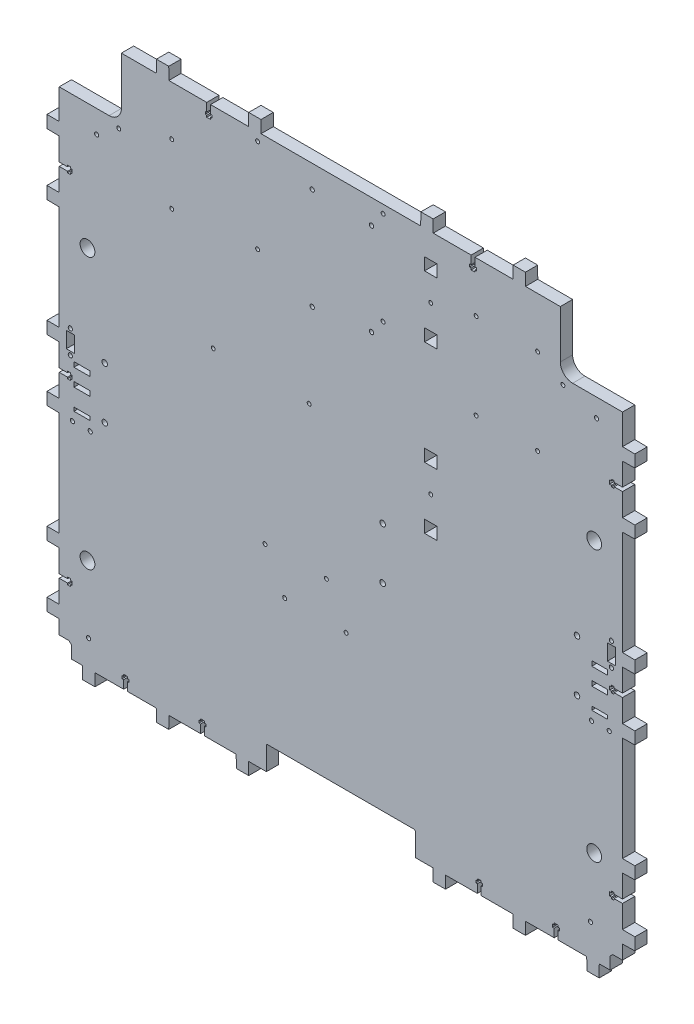
from build123d import *

# Parameters (mm, degrees)
SKETCH_1_R      = 1.6
SKETCH_1_R_2    = 1.7
SKETCH_1_R_3    = 1.75
SKETCH_1_R_4    = 6
SKETCH_1_R_5    = 2.25
SKETCH_1_W      = 6.5
SKETCH_1_H      = 13
SKETCH_1_W_2    = 13
SKETCH_1_H_2    = 4
SKETCH_1_H_3    = 3
SKETCH_1_W_3    = 10.1
SKETCH_1_H_4    = 10
EXTRUDE_1_DEPTH = 10


with BuildPart() as part:
    # Эскиз1 → Бобышка-Вытянуть1 (new body)
    with BuildSketch(Plane.XY):
        with BuildLine():
            Line((114.049433297, -213), (110.949433297, -213))
            Line((110.949433297, -213), (110.949433297, -214.5))
            Line((110.949433297, -214.5), (109.749433297, -214.5))
            Line((109.749433297, -214.5), (109.749433297, -216.7))
            Line((109.749433297, -216.7), (110.949433297, -216.7))
            Line((110.949433297, -216.7), (110.949433297, -223.5))
            Line((110.949433297, -223.5), (85.099433297, -223.5))
            Line((85.099433297, -223.5), (85.06607682, -233.4986114))
            Line((85.06607682, -233.4986114), (75.06607682, -233.4986114))
            Line((75.06607682, -233.4986114), (74.899433297, -223.5))
            Line((74.899433297, -223.5), (60.499433297, -223.5))
            Line((60.499433297, -223.5), (60.499433297, -205))
            ThreePointArc((60.499433297, -205), (60.206540078, -204.292893219), (59.499433297, -204))
            Line((59.499433297, -204), (-59.500566703, -204))
            ThreePointArc((-59.500566703, -204), (-60.207673484, -204.292893219), (-60.500566703, -205))
            Line((-60.500566703, -205), (-60.500566703, -223.5))
            Line((-60.500566703, -223.5), (-74.900566703, -223.5))
            Line((-74.900566703, -223.5), (-74.93392318, -233.4986114))
            Line((-74.93392318, -233.4986114), (-84.93392318, -233.4986114))
            Line((-84.93392318, -233.4986114), (-85.100566703, -223.5))
            Line((-85.100566703, -223.5), (-110.950566703, -223.5))
            Line((-110.950566703, -223.5), (-110.950566703, -216.7))
            Line((-110.950566703, -216.7), (-109.750566703, -216.7))
            Line((-109.750566703, -216.7), (-109.750566703, -214.5))
            Line((-109.750566703, -214.5), (-110.950566703, -214.5))
            Line((-110.950566703, -214.5), (-110.950566703, -213))
            Line((-110.950566703, -213), (-114.050566703, -213))
            Line((-114.050566703, -213), (-114.050566703, -214.5))
            Line((-114.050566703, -214.5), (-115.250566703, -214.5))
            Line((-115.250566703, -214.5), (-115.250566703, -216.7))
            Line((-115.250566703, -216.7), (-114.050566703, -216.7))
            Line((-114.050566703, -216.7), (-114.050566703, -223.5))
            Line((-114.050566703, -223.5), (-139.900566703, -223.5))
            Line((-139.900566703, -223.5), (-139.93392318, -233.4986114))
            Line((-139.93392318, -233.4986114), (-149.93392318, -233.4986114))
            Line((-149.93392318, -233.4986114), (-150.100566703, -223.5))
            Line((-150.100566703, -223.5), (-173.450566703, -223.5))
            Line((-173.450566703, -223.5), (-173.450566703, -216.7))
            Line((-173.450566703, -216.7), (-172.250566703, -216.7))
            Line((-172.250566703, -216.7), (-172.250566703, -214.5))
            Line((-172.250566703, -214.5), (-173.450566703, -214.5))
            Line((-173.450566703, -214.5), (-173.450566703, -213))
            Line((-173.450566703, -213), (-176.550566703, -213))
            Line((-176.550566703, -213), (-176.550566703, -214.5))
            Line((-176.550566703, -214.5), (-177.750566703, -214.5))
            Line((-177.750566703, -214.5), (-177.750566703, -216.7))
            Line((-177.750566703, -216.7), (-176.550566703, -216.7))
            Line((-176.550566703, -216.7), (-176.550566703, -223.5))
            Line((-176.550566703, -223.5), (-199.900566703, -223.5))
            Line((-199.900566703, -223.5), (-199.93392318, -233.4986114))
            Line((-199.93392318, -233.4986114), (-209.93392318, -233.4986114))
            Line((-209.93392318, -233.4986114), (-210.100566703, -223.5))
            Line((-210.100566703, -223.5), (-219.000566703, -223.5))
            Line((-219.000566703, -223.5), (-219.000566703, -213.5))
            Line((-219.000566703, -213.5), (-221.000566703, -211.5))
            Line((-221.000566703, -211.5), (-229.000566703, -211.5))
            Line((-229.000566703, -211.5), (-229.000566703, -200.1))
            Line((-229.000566703, -200.1), (-238.999178103, -199.933356477))
            Line((-238.999178103, -199.933356477), (-238.999178103, -189.933356477))
            Line((-238.999178103, -189.933356477), (-229.000566703, -189.9))
            Line((-229.000566703, -189.9), (-229.000566703, -171.55))
            Line((-229.000566703, -171.55), (-222.200566703, -171.55))
            Line((-222.200566703, -171.55), (-222.200566703, -172.75))
            Line((-222.200566703, -172.75), (-220.000566703, -172.75))
            Line((-220.000566703, -172.75), (-220.000566703, -171.55))
            Line((-220.000566703, -171.55), (-218.500566703, -171.55))
            Line((-218.500566703, -171.55), (-218.500566703, -168.45))
            Line((-218.500566703, -168.45), (-220.000566703, -168.45))
            Line((-220.000566703, -168.45), (-220.000566703, -167.25))
            Line((-220.000566703, -167.25), (-222.200566703, -167.25))
            Line((-222.200566703, -167.25), (-222.200566703, -168.45))
            Line((-222.200566703, -168.45), (-229.000566703, -168.45))
            Line((-229.000566703, -168.45), (-229.000566703, -150.1))
            Line((-229.000566703, -150.1), (-238.999178103, -149.933356477))
            Line((-238.999178103, -149.933356477), (-238.999178103, -139.933356477))
            Line((-238.999178103, -139.933356477), (-229.000566703, -139.9))
            Line((-229.000566703, -139.9), (-229.000566703, -55.1))
            Line((-229.000566703, -55.1), (-238.999178103, -54.933356477))
            Line((-238.999178103, -54.933356477), (-238.999178103, -44.933356477))
            Line((-238.999178103, -44.933356477), (-229.000566703, -44.9))
            Line((-229.000566703, -44.9), (-229.000566703, -26.55))
            Line((-229.000566703, -26.55), (-222.200566703, -26.55))
            Line((-222.200566703, -26.55), (-222.200566703, -27.75))
            Line((-222.200566703, -27.75), (-220.000566703, -27.75))
            Line((-220.000566703, -27.75), (-220.000566703, -26.55))
            Line((-220.000566703, -26.55), (-218.500566703, -26.55))
            Line((-218.500566703, -26.55), (-218.500566703, -23.45))
            Line((-218.500566703, -23.45), (-220.000566703, -23.45))
            Line((-220.000566703, -23.45), (-220.000566703, -22.25))
            Line((-220.000566703, -22.25), (-222.200566703, -22.25))
            Line((-222.200566703, -22.25), (-222.200566703, -23.45))
            Line((-222.200566703, -23.45), (-229.000566703, -23.45))
            Line((-229.000566703, -23.45), (-229.000566703, -5.1))
            Line((-229.000566703, -5.1), (-238.999178103, -4.933356477))
            Line((-238.999178103, -4.933356477), (-238.999178103, 5.066643523))
            Line((-238.999178103, 5.066643523), (-229.000566703, 5.1))
            Line((-229.000566703, 5.1), (-229.000566703, 89.9))
            Line((-229.000566703, 89.9), (-238.999178103, 90.066643523))
            Line((-238.999178103, 90.066643523), (-238.999178103, 100.066643523))
            Line((-238.999178103, 100.066643523), (-229.000566703, 100.1))
            Line((-229.000566703, 100.1), (-229.000566703, 118.45))
            Line((-229.000566703, 118.45), (-222.200566703, 118.45))
            Line((-222.200566703, 118.45), (-222.200566703, 117.25))
            Line((-222.200566703, 117.25), (-220.000566703, 117.25))
            Line((-220.000566703, 117.25), (-220.000566703, 118.45))
            Line((-220.000566703, 118.45), (-218.500566703, 118.45))
            Line((-218.500566703, 118.45), (-218.500566703, 121.55))
            Line((-218.500566703, 121.55), (-220.000566703, 121.55))
            Line((-220.000566703, 121.55), (-220.000566703, 122.75))
            Line((-220.000566703, 122.75), (-222.200566703, 122.75))
            Line((-222.200566703, 122.75), (-222.200566703, 121.55))
            Line((-222.200566703, 121.55), (-229.000566703, 121.55))
            Line((-229.000566703, 121.55), (-229.000566703, 139.9))
            Line((-229.000566703, 139.9), (-238.999178103, 140.066643523))
            Line((-238.999178103, 140.066643523), (-238.999178103, 150.066643523))
            Line((-238.999178103, 150.066643523), (-229.000566703, 150.1))
            Line((-229.000566703, 150.1), (-229.000566703, 174.5))
            Line((-229.000566703, 174.5), (-188.450566703, 174.5))
            ThreePointArc((-188.450566703, 174.5), (-181.379498891, 177.428932188), (-178.450566703, 184.5))
            Line((-178.450566703, 184.5), (-178.450566703, 223.5))
            Line((-178.450566703, 223.5), (-150.100566703, 223.5))
            Line((-150.100566703, 223.5), (-149.93392318, 233.4986114))
            Line((-149.93392318, 233.4986114), (-139.93392318, 233.4986114))
            Line((-139.93392318, 233.4986114), (-139.900566703, 223.5))
            Line((-139.900566703, 223.5), (-109.050566703, 223.5))
            Line((-109.050566703, 223.5), (-109.050566703, 216.7))
            Line((-109.050566703, 216.7), (-110.250566703, 216.7))
            Line((-110.250566703, 216.7), (-110.250566703, 214.5))
            Line((-110.250566703, 214.5), (-109.050566703, 214.5))
            Line((-109.050566703, 214.5), (-109.050566703, 213))
            Line((-109.050566703, 213), (-105.950566703, 213))
            Line((-105.950566703, 213), (-105.950566703, 214.5))
            Line((-105.950566703, 214.5), (-104.750566703, 214.5))
            Line((-104.750566703, 214.5), (-104.750566703, 216.7))
            Line((-104.750566703, 216.7), (-105.950566703, 216.7))
            Line((-105.950566703, 216.7), (-105.950566703, 223.5))
            Line((-105.950566703, 223.5), (-75.100566703, 223.5))
            Line((-75.100566703, 223.5), (-74.93392318, 233.4986114))
            Line((-74.93392318, 233.4986114), (-64.93392318, 233.4986114))
            Line((-64.93392318, 233.4986114), (-64.900566703, 223.5))
            Line((-64.900566703, 223.5), (64.899433297, 223.5))
            Line((64.899433297, 223.5), (65.06607682, 233.4986114))
            Line((65.06607682, 233.4986114), (75.06607682, 233.4986114))
            Line((75.06607682, 233.4986114), (75.099433297, 223.5))
            Line((75.099433297, 223.5), (105.949433297, 223.5))
            Line((105.949433297, 223.5), (105.949433297, 216.7))
            Line((105.949433297, 216.7), (104.749433297, 216.7))
            Line((104.749433297, 216.7), (104.749433297, 214.5))
            Line((104.749433297, 214.5), (105.949433297, 214.5))
            Line((105.949433297, 214.5), (105.949433297, 213))
            Line((105.949433297, 213), (109.049433297, 213))
            Line((109.049433297, 213), (109.049433297, 214.5))
            Line((109.049433297, 214.5), (110.249433297, 214.5))
            Line((110.249433297, 214.5), (110.249433297, 216.7))
            Line((110.249433297, 216.7), (109.049433297, 216.7))
            Line((109.049433297, 216.7), (109.049433297, 223.5))
            Line((109.049433297, 223.5), (139.899433297, 223.5))
            Line((139.899433297, 223.5), (140.06607682, 233.4986114))
            Line((140.06607682, 233.4986114), (150.06607682, 233.4986114))
            Line((150.06607682, 233.4986114), (150.099433297, 223.5))
            Line((150.099433297, 223.5), (178.449433297, 223.5))
            Line((178.449433297, 223.5), (178.449433297, 184.5))
            ThreePointArc((178.449433297, 184.5), (181.378365485, 177.428932188), (188.449433297, 174.5))
            Line((188.449433297, 174.5), (228.999433297, 174.5))
            Line((228.999433297, 174.5), (228.999433297, 150.1))
            Line((228.999433297, 150.1), (238.998044697, 149.933356477))
            Line((238.998044697, 149.933356477), (238.998044697, 140.066643523))
            Line((238.998044697, 140.066643523), (228.999433297, 139.9))
            Line((228.999433297, 139.9), (228.999433297, 121.55))
            Line((228.999433297, 121.55), (222.199433297, 121.55))
            Line((222.199433297, 121.55), (222.199433297, 122.75))
            Line((222.199433297, 122.75), (219.999433297, 122.75))
            Line((219.999433297, 122.75), (219.999433297, 121.55))
            Line((219.999433297, 121.55), (218.499433297, 121.55))
            Line((218.499433297, 121.55), (218.499433297, 118.45))
            Line((218.499433297, 118.45), (219.999433297, 118.45))
            Line((219.999433297, 118.45), (219.999433297, 117.25))
            Line((219.999433297, 117.25), (222.199433297, 117.25))
            Line((222.199433297, 117.25), (222.199433297, 118.45))
            Line((222.199433297, 118.45), (228.999433297, 118.45))
            Line((228.999433297, 118.45), (228.999433297, 100.1))
            Line((228.999433297, 100.1), (238.998044697, 99.933356477))
            Line((238.998044697, 99.933356477), (238.998044697, 90.066643523))
            Line((238.998044697, 90.066643523), (228.999433297, 89.9))
            Line((228.999433297, 89.9), (228.999433297, 5.1))
            Line((228.999433297, 5.1), (238.998044697, 4.933356477))
            Line((238.998044697, 4.933356477), (238.999178103, -5.02855908))
            Line((238.999178103, -5.02855908), (228.999433297, -5.1))
            Line((228.999433297, -5.1), (228.999433297, -23.45))
            Line((228.999433297, -23.45), (222.199433297, -23.45))
            Line((222.199433297, -23.45), (222.199433297, -22.25))
            Line((222.199433297, -22.25), (219.999433297, -22.25))
            Line((219.999433297, -22.25), (219.999433297, -23.45))
            Line((219.999433297, -23.45), (218.499433297, -23.45))
            Line((218.499433297, -23.45), (218.499433297, -26.55))
            Line((218.499433297, -26.55), (219.999433297, -26.55))
            Line((219.999433297, -26.55), (219.999433297, -27.75))
            Line((219.999433297, -27.75), (222.199433297, -27.75))
            Line((222.199433297, -27.75), (222.199433297, -26.55))
            Line((222.199433297, -26.55), (228.999433297, -26.55))
            Line((228.999433297, -26.55), (228.999433297, -44.9))
            Line((228.999433297, -44.9), (238.998044697, -45.066643523))
            Line((238.998044697, -45.066643523), (238.998044697, -54.933356477))
            Line((238.998044697, -54.933356477), (228.999433297, -55.1))
            Line((228.999433297, -55.1), (228.999433297, -139.9))
            Line((228.999433297, -139.9), (238.998044697, -140.066643523))
            Line((238.998044697, -140.066643523), (238.998044697, -149.933356477))
            Line((238.998044697, -149.933356477), (228.999433297, -150.1))
            Line((228.999433297, -150.1), (228.999433297, -168.45))
            Line((228.999433297, -168.45), (222.199433297, -168.45))
            Line((222.199433297, -168.45), (222.199433297, -167.25))
            Line((222.199433297, -167.25), (219.999433297, -167.25))
            Line((219.999433297, -167.25), (219.999433297, -168.45))
            Line((219.999433297, -168.45), (218.499433297, -168.45))
            Line((218.499433297, -168.45), (218.499433297, -171.55))
            Line((218.499433297, -171.55), (219.999433297, -171.55))
            Line((219.999433297, -171.55), (219.999433297, -172.75))
            Line((219.999433297, -172.75), (222.199433297, -172.75))
            Line((222.199433297, -172.75), (222.199433297, -171.55))
            Line((222.199433297, -171.55), (228.999433297, -171.55))
            Line((228.999433297, -171.55), (228.999433297, -189.9))
            Line((228.999433297, -189.9), (238.998044697, -190.066643523))
            Line((238.998044697, -190.066643523), (238.998044697, -199.933356477))
            Line((238.998044697, -199.933356477), (228.999433297, -200.1))
            Line((228.999433297, -200.1), (228.999433297, -211.5))
            Line((228.999433297, -211.5), (220.999433297, -211.5))
            Line((220.999433297, -211.5), (218.999433297, -213.5))
            Line((218.999433297, -213.5), (218.999433297, -223.5))
            Line((218.999433297, -223.5), (210.099433297, -223.5))
            Line((210.099433297, -223.5), (210.06607682, -233.4986114))
            Line((210.06607682, -233.4986114), (200.06607682, -233.4986114))
            Line((200.06607682, -233.4986114), (199.899433297, -223.5))
            Line((199.899433297, -223.5), (176.549433297, -223.5))
            Line((176.549433297, -223.5), (176.549433297, -216.7))
            Line((176.549433297, -216.7), (177.749433297, -216.7))
            Line((177.749433297, -216.7), (177.749433297, -214.5))
            Line((177.749433297, -214.5), (176.549433297, -214.5))
            Line((176.549433297, -214.5), (176.549433297, -213))
            Line((176.549433297, -213), (173.449433297, -213))
            Line((173.449433297, -213), (173.449433297, -214.5))
            Line((173.449433297, -214.5), (172.249433297, -214.5))
            Line((172.249433297, -214.5), (172.249433297, -216.7))
            Line((172.249433297, -216.7), (173.449433297, -216.7))
            Line((173.449433297, -216.7), (173.449433297, -223.5))
            Line((173.449433297, -223.5), (150.099433297, -223.5))
            Line((150.099433297, -223.5), (150.06607682, -233.4986114))
            Line((150.06607682, -233.4986114), (140.06607682, -233.4986114))
            Line((140.06607682, -233.4986114), (139.899433297, -223.5))
            Line((139.899433297, -223.5), (114.049433297, -223.5))
            Line((114.049433297, -223.5), (114.049433297, -216.7))
            Line((114.049433297, -216.7), (115.249433297, -216.7))
            Line((115.249433297, -216.7), (115.249433297, -214.5))
            Line((115.249433297, -214.5), (114.049433297, -214.5))
            Line((114.049433297, -214.5), (114.049433297, -213))
        make_face()
        with Locations((-25.757877317, 52.950742635)):
            Circle(SKETCH_1_R, mode=Mode.SUBTRACT)
        with Locations((-205.151694174, -201.751829431)):
            Circle(SKETCH_1_R_2, mode=Mode.SUBTRACT)
        with Locations((-198.593347861, 156.115993109)):
            Circle(SKETCH_1_R_2, mode=Mode.SUBTRACT)
        with Locations((207.884435226, 159.544219591)):
            Circle(SKETCH_1_R_2, mode=Mode.SUBTRACT)
        with Locations((202.911289635, -197.501120433)):
            Circle(SKETCH_1_R_2, mode=Mode.SUBTRACT)
        with Locations((180.549433297, 169.4)):
            Circle(SKETCH_1_R, mode=Mode.SUBTRACT)
        with Locations((-180.550566703, 169.4)):
            Circle(SKETCH_1_R, mode=Mode.SUBTRACT)
        with Locations((-137.515917296, 134.354094582)):
            Circle(SKETCH_1_R, mode=Mode.SUBTRACT)
        with Locations((-137.515917296, 183.354094582)):
            Circle(SKETCH_1_R, mode=Mode.SUBTRACT)
        with Locations((4.213374188, -93.323584265)):
            Circle(SKETCH_1_R, mode=Mode.SUBTRACT)
        with Locations((-11.786625812, -63.323584265)):
            Circle(SKETCH_1_R, mode=Mode.SUBTRACT)
        with Locations((-103.757877317, 52.950742635)):
            Circle(SKETCH_1_R, mode=Mode.SUBTRACT)
        with Locations((-23.285862329, 122.483510489)):
            Circle(SKETCH_1_R_3, mode=Mode.SUBTRACT)
        with Locations((-23.285862329, 205.033510489)):
            Circle(SKETCH_1_R_3, mode=Mode.SUBTRACT)
        with Locations((24.974137671, 128.833510489)):
            Circle(SKETCH_1_R_3, mode=Mode.SUBTRACT)
        with Locations((24.974137671, 203.763510489)):
            Circle(SKETCH_1_R_3, mode=Mode.SUBTRACT)
        with Locations((34.318742671, 140.793337489)):
            Circle(SKETCH_1_R, mode=Mode.SUBTRACT)
        with Locations((34.318742671, 216.793337489)):
            Circle(SKETCH_1_R, mode=Mode.SUBTRACT)
        with Locations((-67.681257329, 140.793337489)):
            Circle(SKETCH_1_R, mode=Mode.SUBTRACT)
        with Locations((-67.681257329, 216.793337489)):
            Circle(SKETCH_1_R, mode=Mode.SUBTRACT)
        with Locations((205.999433297, 72.5)):
            Circle(SKETCH_1_R_4, mode=Mode.SUBTRACT)
        with Locations((205.999433297, -147.5)):
            Circle(SKETCH_1_R_4, mode=Mode.SUBTRACT)
        with Locations((219.949433297, -10.061822)):
            Circle(SKETCH_1_R_2, mode=Mode.SUBTRACT)
        with Locations((219.949433297, 8.938178)):
            Circle(SKETCH_1_R_2, mode=Mode.SUBTRACT)
        with Locations((218.205278032, -55.487549568)):
            Circle(SKETCH_1_R_2, mode=Mode.SUBTRACT)
        with Locations((203.805278032, -55.487549568)):
            Circle(SKETCH_1_R_2, mode=Mode.SUBTRACT)
        with Locations((-206.000566703, 72.5)):
            Circle(SKETCH_1_R_4, mode=Mode.SUBTRACT)
        with Locations((-206.000566703, -147.5)):
            Circle(SKETCH_1_R_4, mode=Mode.SUBTRACT)
        with Locations((-219.950566703, -10.061822)):
            Circle(SKETCH_1_R_2, mode=Mode.SUBTRACT)
        with Locations((-219.950566703, 8.938178)):
            Circle(SKETCH_1_R_2, mode=Mode.SUBTRACT)
        with Locations((-218.206411439, -55.487549568)):
            Circle(SKETCH_1_R_2, mode=Mode.SUBTRACT)
        with Locations((-203.806411439, -55.487549568)):
            Circle(SKETCH_1_R_2, mode=Mode.SUBTRACT)
        with Locations((192.005278032, -43.5)):
            Circle(SKETCH_1_R_5, mode=Mode.SUBTRACT)
        with Locations((192.005278032, -1.5)):
            Circle(SKETCH_1_R_5, mode=Mode.SUBTRACT)
        with Locations((-192.006411439, -43.5)):
            Circle(SKETCH_1_R_5, mode=Mode.SUBTRACT)
        with Locations((-192.006411439, -1.5)):
            Circle(SKETCH_1_R_5, mode=Mode.SUBTRACT)
        with Locations((73.099433297, 173.4)):
            Circle(SKETCH_1_R, mode=Mode.SUBTRACT)
        with Locations((73.099433297, 38.6)):
            Circle(SKETCH_1_R, mode=Mode.SUBTRACT)
        with Locations((34.005278032, -43.5)):
            Circle(SKETCH_1_R_5, mode=Mode.SUBTRACT)
        with Locations((34.005278032, -1.5)):
            Circle(SKETCH_1_R_5, mode=Mode.SUBTRACT)
        with Locations((-45.654447904, -93.854083436)):
            Circle(SKETCH_1_R, mode=Mode.SUBTRACT)
        with Locations((-61.654447904, -63.854083436)):
            Circle(SKETCH_1_R, mode=Mode.SUBTRACT)
        with Locations((159.980754413, 112.533631471)):
            Circle(SKETCH_1_R, mode=Mode.SUBTRACT)
        with Locations((159.980754413, 182.533631471)):
            Circle(SKETCH_1_R, mode=Mode.SUBTRACT)
        with Locations((109.980754413, 112.533631471)):
            Circle(SKETCH_1_R, mode=Mode.SUBTRACT)
        with Locations((109.980754413, 182.533631471)):
            Circle(SKETCH_1_R, mode=Mode.SUBTRACT)
        with Locations((219.949433297, -0.561822)):
            Rectangle(SKETCH_1_W, SKETCH_1_H, mode=Mode.SUBTRACT)
        with Locations((210.505278032, -15)):
            Rectangle(SKETCH_1_W_2, SKETCH_1_H_2, mode=Mode.SUBTRACT)
        with Locations((210.505278032, -29)):
            Rectangle(SKETCH_1_W_2, SKETCH_1_H_2, mode=Mode.SUBTRACT)
        with Locations((210.505278032, -46.5)):
            Rectangle(SKETCH_1_W_2, SKETCH_1_H_3, mode=Mode.SUBTRACT)
        with Locations((-219.950566703, -0.561822)):
            Rectangle(SKETCH_1_W, SKETCH_1_H, mode=Mode.SUBTRACT)
        with Locations((-210.506411439, -15)):
            Rectangle(SKETCH_1_W_2, SKETCH_1_H_2, mode=Mode.SUBTRACT)
        with Locations((-210.506411439, -29)):
            Rectangle(SKETCH_1_W_2, SKETCH_1_H_2, mode=Mode.SUBTRACT)
        with Locations((-210.506411439, -46.5)):
            Rectangle(SKETCH_1_W_2, SKETCH_1_H_3, mode=Mode.SUBTRACT)
        with Locations((73.099433297, 198.4)):
            Rectangle(SKETCH_1_W_3, SKETCH_1_H_4, mode=Mode.SUBTRACT)
        with Locations((73.099433297, 148.4)):
            Rectangle(SKETCH_1_W_3, SKETCH_1_H_4, mode=Mode.SUBTRACT)
        with Locations((73.099433297, 63.6)):
            Rectangle(SKETCH_1_W_3, SKETCH_1_H_4, mode=Mode.SUBTRACT)
        with Locations((73.099433297, 13.6)):
            Rectangle(SKETCH_1_W_3, SKETCH_1_H_4, mode=Mode.SUBTRACT)
    extrude(amount=EXTRUDE_1_DEPTH)


solid = part.part
